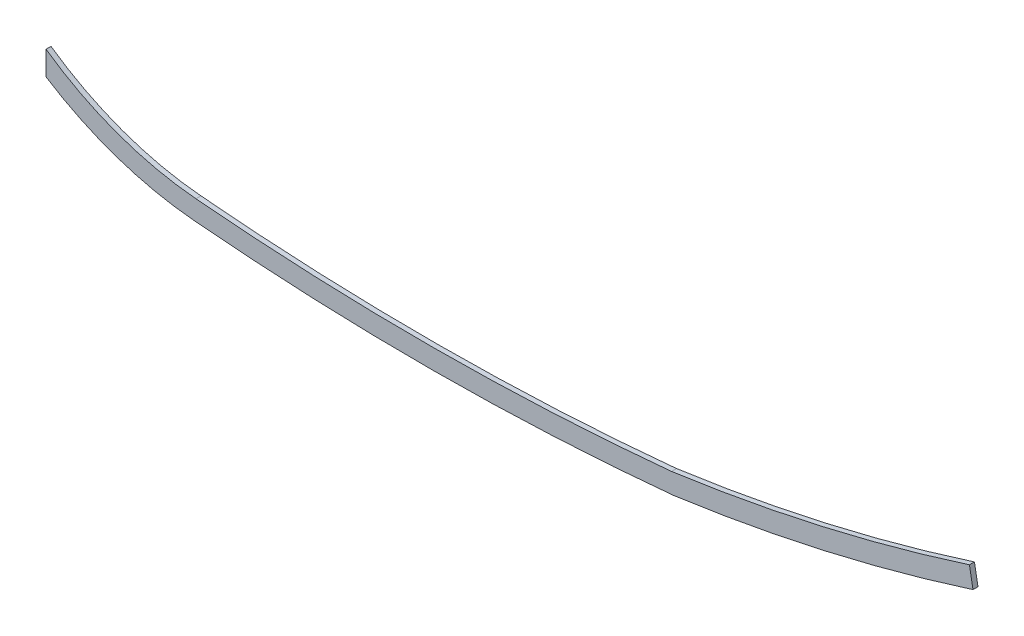
from build123d import *

# Parameters (mm, degrees)
BOSS_EXTRUDE1_DEPTH = 1.5875


with BuildPart() as part:
    # Sketch2 → Boss-Extrude1 (new, symmetric)
    with BuildSketch(Plane.XY):
        with BuildLine():
            Line((0, -93.726), (0, -78.486))
            ThreePointArc((0, -78.486), (45.497909529, -102.143988159), (95.5675, -113.225336692))
            ThreePointArc((95.5675, -113.225336692), (247.168367606, -119.728946816), (398.720709803, -112.17861051))
            ThreePointArc((398.720709803, -112.17861051), (494.586291489, -94.575813643), (588.578984507, -68.779653684))
            Line((588.578984507, -68.779653684), (590.864339182, -81.353629169))
            ThreePointArc((590.864339182, -81.353629169), (496.464017617, -107.14437724), (400.203586993, -124.765753286))
            ThreePointArc((400.203586993, -124.765753286), (247.115945932, -132.400573942), (93.98, -125.805242584))
            ThreePointArc((93.98, -125.805242584), (45.058861039, -115.423125179), (0, -93.726))
        make_face()
    extrude(amount=BOSS_EXTRUDE1_DEPTH, both=True)


solid = part.part
